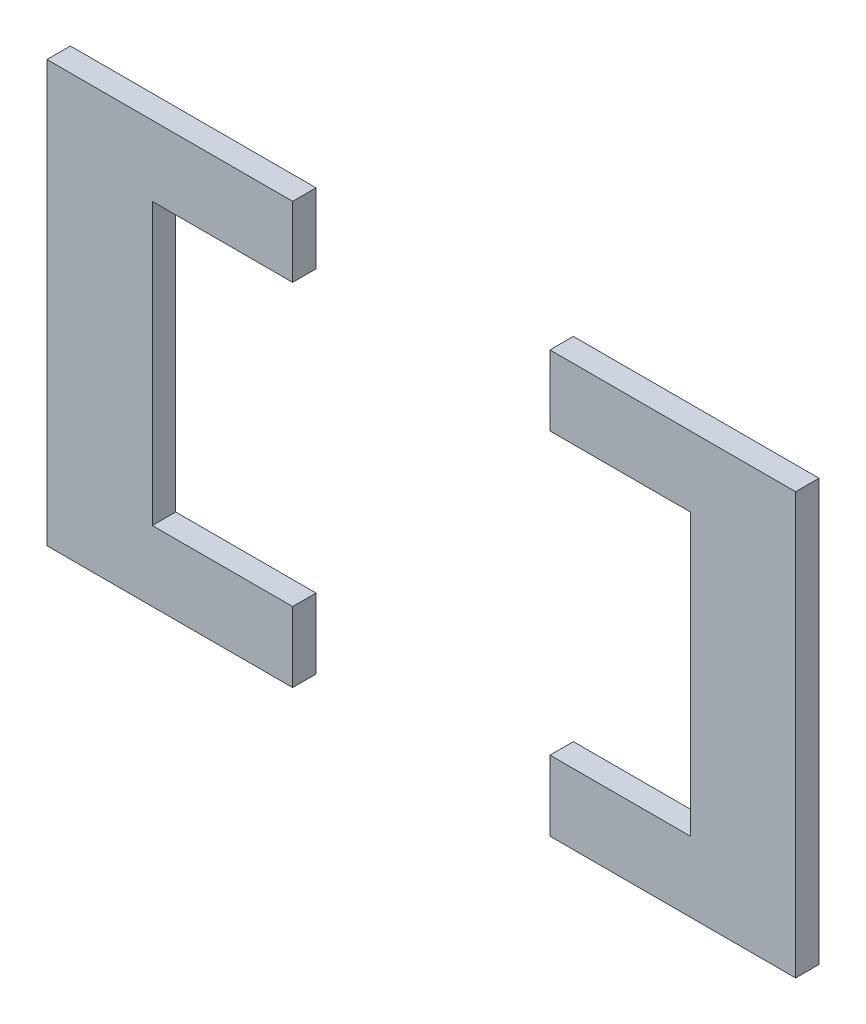
from build123d import *

# Parameters (mm, degrees)
BOSS_EXTRUDE1_DEPTH   = 1
BOSS_EXTRUDE1_2_DEPTH = 1


with BuildPart() as part:
    # Sketch1 → Boss-Extrude1 (new body)
    with BuildSketch(Plane.XY):
        Polygon((0, 66.5), (10.5, 66.5), (10.5, 48.5), (0, 48.5), (0, 51.5), (6, 51.5), (6, 63.5), (0, 63.5), align=None)
    extrude(amount=BOSS_EXTRUDE1_DEPTH)


with BuildPart() as body_2:
    # Sketch1 → Boss-Extrude1 2 (new body)
    with BuildSketch(Plane.XY):
        Polygon((-11, 66.5), (-21.5, 66.5), (-21.5, 48.5), (-11, 48.5), (-11, 51.5), (-17, 51.5), (-17, 63.5), (-11, 63.5), align=None)
    extrude(amount=BOSS_EXTRUDE1_2_DEPTH)


solid = Compound([part.part, body_2.part])
